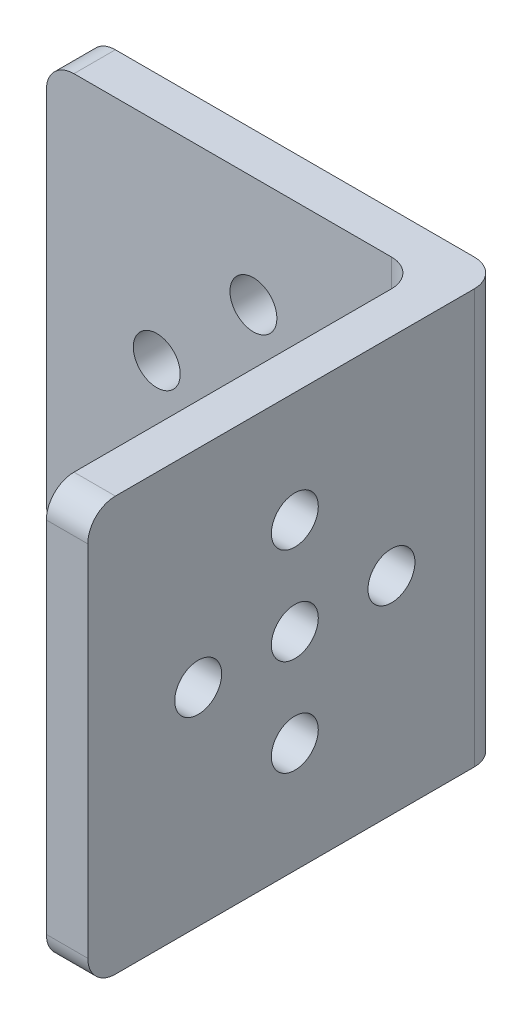
from build123d import *

# Parameters (mm, degrees)
SKETCH1_W                      = 27
SKETCH1_H                      = 30
BOSS_EXTRUDE1_DEPTH            = 3
SKETCH1_3_W                    = 3
SKETCH1_3_H                    = 30
BOSS_EXTRUDE2_DEPTH            = 30
M3_CLEARANCE_HOLE1_D           = 3.4
M3_CLEARANCE_HOLE1_ON_FACE_2_D = 3.4
M3_CLEARANCE_HOLE2_D           = 3.4
FILLET1_R                      = 2
FILLET2_R                      = 2


with BuildPart() as part:
    # Sketch1 → Boss-Extrude1 (new body)
    with BuildSketch(Plane.XY):
        with Locations((-1.5, 0)):
            Rectangle(SKETCH1_W, SKETCH1_H)
    extrude(amount=BOSS_EXTRUDE1_DEPTH)

    # Sketch1<3> → Boss-Extrude2 (add)
    with BuildSketch(Plane.XY):
        with Locations((13.5, 0)):
            Rectangle(SKETCH1_3_W, SKETCH1_3_H)
    extrude(amount=BOSS_EXTRUDE2_DEPTH)

    # M3 Clearance Hole1 (through all)
    with Locations(Plane(origin=(0, 7, 3), x_dir=(1, 0, 0), z_dir=(0, 0, 1))):
        with Locations((0, 0), (-7, -7), (7, -7), (0, -14), (0, -7)):
            Hole(M3_CLEARANCE_HOLE1_D / 2)

    # M3 Clearance Hole1 on face 2 (through all)
    with Locations(Plane(origin=(0, 0, 0), x_dir=(-1, 0, 0), z_dir=(0, 0, -1))):
        with Locations((0, 0)):
            Hole(M3_CLEARANCE_HOLE1_ON_FACE_2_D / 2)

    # M3 Clearance Hole2 (through all)
    with Locations(Plane(origin=(15, 7, 15), x_dir=(0, 1, 0), z_dir=(1, 0, 0))):
        with Locations((0, 0), (-7, 7), (-7, 0), (-7, -7), (-14, 0)):
            Hole(M3_CLEARANCE_HOLE2_D / 2)

    # Fillet1
    fillet1_edges = [part.edges().sort_by_distance(p)[0] for p in [
        (15, 0, 0),
        (12, 0, 3),
    ]]
    fillet(fillet1_edges, radius=FILLET1_R)

    # Fillet2
    fillet2_edges = [part.edges().sort_by_distance(p)[0] for p in [
        (13.5, 15, 30),
        (13.5, -15, 30),
        (-15, -15, 1.5),
        (-15, 15, 1.5),
    ]]
    fillet(fillet2_edges, radius=FILLET2_R)


solid = part.part
